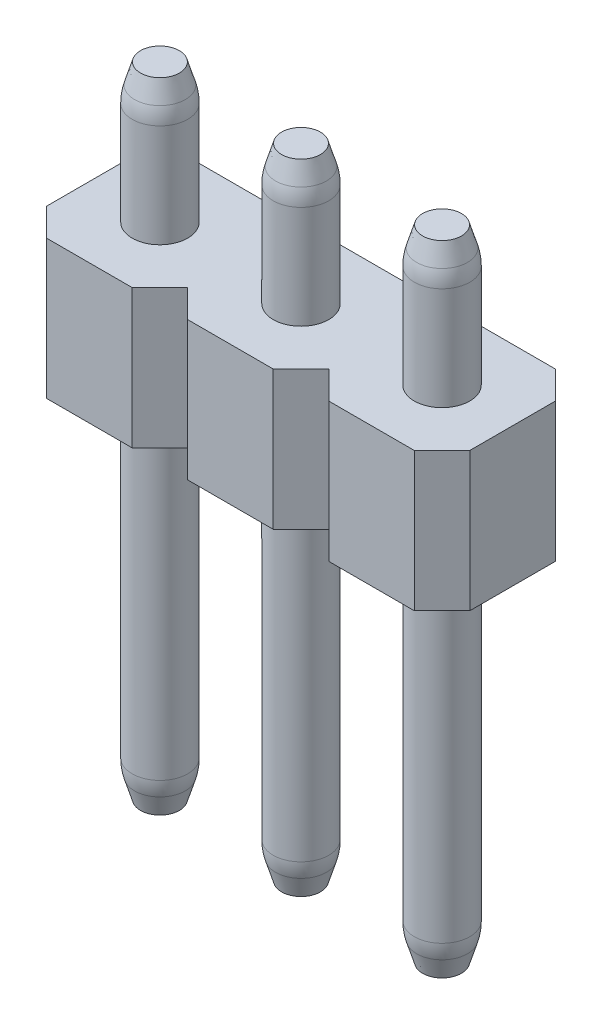
from build123d import *
from OCP.BRepFilletAPI import BRepFilletAPI_MakeChamfer

# Parameters (mm, degrees)
SKETCH1_R               = 0.5
BOSS_EXTRUDE1_DEPTH     = 11.5
BOSS_EXTRUDE1_2_DEPTH   = 11.5
BOSS_EXTRUDE1_3_DEPTH   = 11.5
BOSS_EXTRUDE1_4_DEPTH   = 11.5
BOSS_EXTRUDE1_5_DEPTH   = 11.5
BOSS_EXTRUDE1_6_DEPTH   = 11.5
BOSS_EXTRUDE1_7_DEPTH   = 11.5
BOSS_EXTRUDE1_8_DEPTH   = 11.5
BOSS_EXTRUDE1_9_DEPTH   = 11.5
BOSS_EXTRUDE1_10_DEPTH  = 11.5
BOSS_EXTRUDE1_11_DEPTH  = 11.5
BOSS_EXTRUDE1_12_DEPTH  = 11.5
BOSS_EXTRUDE1_13_DEPTH  = 11.5
BOSS_EXTRUDE1_14_DEPTH  = 11.5
BOSS_EXTRUDE1_15_DEPTH  = 11.5
BOSS_EXTRUDE1_16_DEPTH  = 11.5
BOSS_EXTRUDE2_DEPTH     = 2.5
CHAMFER1_SIZE           = 0.5
CHAMFER1_SIZE2          = 0.15
FILLET1_R               = 1
CHAMFER2_SIZE           = 0.15
CHAMFER2_SIZE2          = 0.5
FILLET2_R               = 1
CUT_EXTRUDE1_DEPTH      = 42.093776929
CUT_EXTRUDE1_DEPTH_BACK = 42.093776929


with BuildPart() as part:
    # Sketch1 → Boss-Extrude1 (new body)
    with BuildSketch(Plane(origin=(0, 0, 0), x_dir=(1, 0, 0), z_dir=(0, 1, 0))):
        with Locations(Location((0, 0, 0), (0, 0, 270))):
            Circle(SKETCH1_R)
    extrude(amount=BOSS_EXTRUDE1_DEPTH)



with BuildPart() as body_2:
    # Sketch1 → Boss-Extrude1 2 (new body)
    with BuildSketch(Plane(origin=(0, 0, 0), x_dir=(1, 0, 0), z_dir=(0, 1, 0))):
        with Locations(Location((2.54, 0, 0), (0, 0, 270))):
            Circle(SKETCH1_R)
    extrude(amount=BOSS_EXTRUDE1_2_DEPTH)


with BuildPart() as body_3:
    # Sketch1 → Boss-Extrude1 3 (new body)
    with BuildSketch(Plane(origin=(0, 0, 0), x_dir=(1, 0, 0), z_dir=(0, 1, 0))):
        with Locations(Location((5.08, 0, 0), (0, 0, 270))):
            Circle(SKETCH1_R)
    extrude(amount=BOSS_EXTRUDE1_3_DEPTH)


with BuildPart() as body_4:
    # Sketch1 → Boss-Extrude1 4 (new body)
    with BuildSketch(Plane(origin=(0, 0, 0), x_dir=(1, 0, 0), z_dir=(0, 1, 0))):
        with Locations(Location((7.62, 0, 0), (0, 0, 270))):
            Circle(SKETCH1_R)
    extrude(amount=BOSS_EXTRUDE1_4_DEPTH)


with BuildPart() as body_5:
    # Sketch1 → Boss-Extrude1 5 (new body)
    with BuildSketch(Plane(origin=(0, 0, 0), x_dir=(1, 0, 0), z_dir=(0, 1, 0))):
        with Locations(Location((10.16, 0, 0), (0, 0, 270))):
            Circle(SKETCH1_R)
    extrude(amount=BOSS_EXTRUDE1_5_DEPTH)


with BuildPart() as body_6:
    # Sketch1 → Boss-Extrude1 6 (new body)
    with BuildSketch(Plane(origin=(0, 0, 0), x_dir=(1, 0, 0), z_dir=(0, 1, 0))):
        with Locations(Location((12.7, 0, 0), (0, 0, 270))):
            Circle(SKETCH1_R)
    extrude(amount=BOSS_EXTRUDE1_6_DEPTH)


with BuildPart() as body_7:
    # Sketch1 → Boss-Extrude1 7 (new body)
    with BuildSketch(Plane(origin=(0, 0, 0), x_dir=(1, 0, 0), z_dir=(0, 1, 0))):
        with Locations(Location((15.24, 0, 0), (0, 0, 270))):
            Circle(SKETCH1_R)
    extrude(amount=BOSS_EXTRUDE1_7_DEPTH)


with BuildPart() as body_8:
    # Sketch1 → Boss-Extrude1 8 (new body)
    with BuildSketch(Plane(origin=(0, 0, 0), x_dir=(1, 0, 0), z_dir=(0, 1, 0))):
        with Locations(Location((17.78, 0, 0), (0, 0, 270))):
            Circle(SKETCH1_R)
    extrude(amount=BOSS_EXTRUDE1_8_DEPTH)


with BuildPart() as body_9:
    # Sketch1 → Boss-Extrude1 9 (new body)
    with BuildSketch(Plane(origin=(0, 0, 0), x_dir=(1, 0, 0), z_dir=(0, 1, 0))):
        with Locations(Location((20.32, 0, 0), (0, 0, 270))):
            Circle(SKETCH1_R)
    extrude(amount=BOSS_EXTRUDE1_9_DEPTH)


with BuildPart() as body_10:
    # Sketch1 → Boss-Extrude1 10 (new body)
    with BuildSketch(Plane(origin=(0, 0, 0), x_dir=(1, 0, 0), z_dir=(0, 1, 0))):
        with Locations(Location((22.86, 0, 0), (0, 0, 270))):
            Circle(SKETCH1_R)
    extrude(amount=BOSS_EXTRUDE1_10_DEPTH)


with BuildPart() as body_11:
    # Sketch1 → Boss-Extrude1 11 (new body)
    with BuildSketch(Plane(origin=(0, 0, 0), x_dir=(1, 0, 0), z_dir=(0, 1, 0))):
        with Locations(Location((25.4, 0, 0), (0, 0, 270))):
            Circle(SKETCH1_R)
    extrude(amount=BOSS_EXTRUDE1_11_DEPTH)


with BuildPart() as body_12:
    # Sketch1 → Boss-Extrude1 12 (new body)
    with BuildSketch(Plane(origin=(0, 0, 0), x_dir=(1, 0, 0), z_dir=(0, 1, 0))):
        with Locations(Location((27.94, 0, 0), (0, 0, 270))):
            Circle(SKETCH1_R)
    extrude(amount=BOSS_EXTRUDE1_12_DEPTH)


with BuildPart() as body_13:
    # Sketch1 → Boss-Extrude1 13 (new body)
    with BuildSketch(Plane(origin=(0, 0, 0), x_dir=(1, 0, 0), z_dir=(0, 1, 0))):
        with Locations(Location((30.48, 0, 0), (0, 0, 270))):
            Circle(SKETCH1_R)
    extrude(amount=BOSS_EXTRUDE1_13_DEPTH)


with BuildPart() as body_14:
    # Sketch1 → Boss-Extrude1 14 (new body)
    with BuildSketch(Plane(origin=(0, 0, 0), x_dir=(1, 0, 0), z_dir=(0, 1, 0))):
        with Locations(Location((33.02, 0, 0), (0, 0, 270))):
            Circle(SKETCH1_R)
    extrude(amount=BOSS_EXTRUDE1_14_DEPTH)


with BuildPart() as body_15:
    # Sketch1 → Boss-Extrude1 15 (new body)
    with BuildSketch(Plane(origin=(0, 0, 0), x_dir=(1, 0, 0), z_dir=(0, 1, 0))):
        with Locations(Location((35.56, 0, 0), (0, 0, 270))):
            Circle(SKETCH1_R)
    extrude(amount=BOSS_EXTRUDE1_15_DEPTH)


with BuildPart() as body_16:
    # Sketch1 → Boss-Extrude1 16 (new body)
    with BuildSketch(Plane(origin=(0, 0, 0), x_dir=(1, 0, 0), z_dir=(0, 1, 0))):
        with Locations(Location((38.1, 0, 0), (0, 0, 270))):
            Circle(SKETCH1_R)
    extrude(amount=BOSS_EXTRUDE1_16_DEPTH)


with BuildPart() as part_1:
    add(part.part)

    add(body_2.part)  # Boss-Extrude2 merges body 2

    add(body_3.part)  # Boss-Extrude2 merges body 3

    add(body_4.part)  # Boss-Extrude2 merges body 4

    add(body_5.part)  # Boss-Extrude2 merges body 5

    add(body_6.part)  # Boss-Extrude2 merges body 6

    add(body_7.part)  # Boss-Extrude2 merges body 7

    add(body_8.part)  # Boss-Extrude2 merges body 8

    add(body_9.part)  # Boss-Extrude2 merges body 9

    add(body_10.part)  # Boss-Extrude2 merges body 10

    add(body_11.part)  # Boss-Extrude2 merges body 11

    add(body_12.part)  # Boss-Extrude2 merges body 12

    add(body_13.part)  # Boss-Extrude2 merges body 13

    add(body_14.part)  # Boss-Extrude2 merges body 14

    add(body_15.part)  # Boss-Extrude2 merges body 15

    add(body_16.part)  # Boss-Extrude2 merges body 16
    # Sketch2 → Boss-Extrude2 (add)
    with BuildSketch(Plane(origin=(0, 6.5, 0), x_dir=(1, 0, 0), z_dir=(0, 1, 0))):
        Polygon((-1.27, 0.77), (-0.77, 1.27), (0.77, 1.27), (1.27, 0.77), (1.77, 1.27), (3.31, 1.27), (3.81, 0.77), (4.31, 1.27), (5.85, 1.27), (6.35, 0.77), (6.85, 1.27), (8.39, 1.27), (8.89, 0.77), (9.39, 1.27), (10.93, 1.27), (11.43, 0.77), (11.93, 1.27), (13.47, 1.27), (13.97, 0.77), (14.47, 1.27), (16.01, 1.27), (16.51, 0.77), (17.01, 1.27), (18.55, 1.27), (19.05, 0.77), (19.55, 1.27), (21.09, 1.27), (21.59, 0.77), (22.09, 1.27), (23.63, 1.27), (24.13, 0.77), (24.63, 1.27), (26.17, 1.27), (26.67, 0.77), (27.17, 1.27), (28.71, 1.27), (29.21, 0.77), (29.71, 1.27), (31.25, 1.27), (31.75, 0.77), (32.25, 1.27), (33.79, 1.27), (34.29, 0.77), (34.79, 1.27), (36.33, 1.27), (36.83, 0.77), (37.33, 1.27), (38.87, 1.27), (39.37, 0.77), (39.37, -0.77), (38.87, -1.27), (37.33, -1.27), (36.83, -0.77), (36.33, -1.27), (34.79, -1.27), (34.29, -0.77), (33.79, -1.27), (32.25, -1.27), (31.75, -0.77), (31.25, -1.27), (29.71, -1.27), (29.21, -0.77), (28.71, -1.27), (27.17, -1.27), (26.67, -0.77), (26.17, -1.27), (24.63, -1.27), (24.13, -0.77), (23.63, -1.27), (22.09, -1.27), (21.59, -0.77), (21.09, -1.27), (19.55, -1.27), (19.05, -0.77), (18.55, -1.27), (17.01, -1.27), (16.51, -0.77), (16.01, -1.27), (14.47, -1.27), (13.97, -0.77), (13.47, -1.27), (11.93, -1.27), (11.43, -0.77), (10.93, -1.27), (9.39, -1.27), (8.89, -0.77), (8.39, -1.27), (6.85, -1.27), (6.35, -0.77), (5.85, -1.27), (4.31, -1.27), (3.81, -0.77), (3.31, -1.27), (1.77, -1.27), (1.27, -0.77), (0.77, -1.27), (-0.77, -1.27), (-1.27, -0.77), align=None)
    extrude(amount=BOSS_EXTRUDE2_DEPTH)

    # Chamfer1: one chamfer whose edges measure the first distance from different faces: ONE call of the kernel's chamfer builder (chamfer() names one face for all edges)
    chamfer1_edges_1 = [part_1.edges().sort_by_distance(p)[0] for p in [
        (2.54, 11.5, -0.5),
    ]]
    chamfer1_side_1 = [part_1.faces().sort_by_distance(p)[0] for p in [
        (2.54, 10.25, -0.5),
    ]]
    chamfer1_edges_2 = [part_1.edges().sort_by_distance(p)[0] for p in [
        (5.08, 11.5, -0.5),
    ]]
    chamfer1_side_2 = [part_1.faces().sort_by_distance(p)[0] for p in [
        (5.08, 10.25, -0.5),
    ]]
    chamfer1_edges_3 = [part_1.edges().sort_by_distance(p)[0] for p in [
        (7.62, 11.5, -0.5),
    ]]
    chamfer1_side_3 = [part_1.faces().sort_by_distance(p)[0] for p in [
        (7.62, 10.25, -0.5),
    ]]
    chamfer1_edges_4 = [part_1.edges().sort_by_distance(p)[0] for p in [
        (10.16, 11.5, -0.5),
    ]]
    chamfer1_side_4 = [part_1.faces().sort_by_distance(p)[0] for p in [
        (10.16, 10.25, -0.5),
    ]]
    chamfer1_edges_5 = [part_1.edges().sort_by_distance(p)[0] for p in [
        (12.7, 11.5, -0.5),
    ]]
    chamfer1_side_5 = [part_1.faces().sort_by_distance(p)[0] for p in [
        (12.7, 10.25, -0.5),
    ]]
    chamfer1_edges_6 = [part_1.edges().sort_by_distance(p)[0] for p in [
        (15.24, 11.5, -0.5),
    ]]
    chamfer1_side_6 = [part_1.faces().sort_by_distance(p)[0] for p in [
        (15.24, 10.25, -0.5),
    ]]
    chamfer1_edges_7 = [part_1.edges().sort_by_distance(p)[0] for p in [
        (17.78, 11.5, -0.5),
    ]]
    chamfer1_side_7 = [part_1.faces().sort_by_distance(p)[0] for p in [
        (17.78, 10.25, -0.5),
    ]]
    chamfer1_edges_8 = [part_1.edges().sort_by_distance(p)[0] for p in [
        (20.32, 11.5, -0.5),
    ]]
    chamfer1_side_8 = [part_1.faces().sort_by_distance(p)[0] for p in [
        (20.32, 10.25, -0.5),
    ]]
    chamfer1_edges_9 = [part_1.edges().sort_by_distance(p)[0] for p in [
        (22.86, 11.5, -0.5),
    ]]
    chamfer1_side_9 = [part_1.faces().sort_by_distance(p)[0] for p in [
        (22.86, 10.25, -0.5),
    ]]
    chamfer1_edges_10 = [part_1.edges().sort_by_distance(p)[0] for p in [
        (25.4, 11.5, -0.5),
    ]]
    chamfer1_side_10 = [part_1.faces().sort_by_distance(p)[0] for p in [
        (25.4, 10.25, -0.5),
    ]]
    chamfer1_edges_11 = [part_1.edges().sort_by_distance(p)[0] for p in [
        (27.94, 11.5, -0.5),
    ]]
    chamfer1_side_11 = [part_1.faces().sort_by_distance(p)[0] for p in [
        (27.94, 10.25, -0.5),
    ]]
    chamfer1_edges_12 = [part_1.edges().sort_by_distance(p)[0] for p in [
        (30.48, 11.5, -0.5),
    ]]
    chamfer1_side_12 = [part_1.faces().sort_by_distance(p)[0] for p in [
        (30.48, 10.25, -0.5),
    ]]
    chamfer1_edges_13 = [part_1.edges().sort_by_distance(p)[0] for p in [
        (33.02, 11.5, -0.5),
    ]]
    chamfer1_side_13 = [part_1.faces().sort_by_distance(p)[0] for p in [
        (33.02, 10.25, -0.5),
    ]]
    chamfer1_edges_14 = [part_1.edges().sort_by_distance(p)[0] for p in [
        (35.56, 11.5, -0.5),
    ]]
    chamfer1_side_14 = [part_1.faces().sort_by_distance(p)[0] for p in [
        (35.56, 10.25, -0.5),
    ]]
    chamfer1_edges_15 = [part_1.edges().sort_by_distance(p)[0] for p in [
        (38.1, 11.5, -0.5),
    ]]
    chamfer1_side_15 = [part_1.faces().sort_by_distance(p)[0] for p in [
        (38.1, 10.25, -0.5),
    ]]
    chamfer1_edges_16 = [part_1.edges().sort_by_distance(p)[0] for p in [
        (0, 11.5, -0.5),
    ]]
    chamfer1_side_16 = [part_1.faces().sort_by_distance(p)[0] for p in [
        (0, 10.25, -0.5),
    ]]
    chamfer1 = BRepFilletAPI_MakeChamfer(part_1.part.solid().wrapped)
    for e in chamfer1_edges_1:
        chamfer1.Add(CHAMFER1_SIZE, CHAMFER1_SIZE2, e.wrapped, chamfer1_side_1[0].wrapped)  # the first distance lies on this face
    for e in chamfer1_edges_2:
        chamfer1.Add(CHAMFER1_SIZE, CHAMFER1_SIZE2, e.wrapped, chamfer1_side_2[0].wrapped)  # the first distance lies on this face
    for e in chamfer1_edges_3:
        chamfer1.Add(CHAMFER1_SIZE, CHAMFER1_SIZE2, e.wrapped, chamfer1_side_3[0].wrapped)  # the first distance lies on this face
    for e in chamfer1_edges_4:
        chamfer1.Add(CHAMFER1_SIZE, CHAMFER1_SIZE2, e.wrapped, chamfer1_side_4[0].wrapped)  # the first distance lies on this face
    for e in chamfer1_edges_5:
        chamfer1.Add(CHAMFER1_SIZE, CHAMFER1_SIZE2, e.wrapped, chamfer1_side_5[0].wrapped)  # the first distance lies on this face
    for e in chamfer1_edges_6:
        chamfer1.Add(CHAMFER1_SIZE, CHAMFER1_SIZE2, e.wrapped, chamfer1_side_6[0].wrapped)  # the first distance lies on this face
    for e in chamfer1_edges_7:
        chamfer1.Add(CHAMFER1_SIZE, CHAMFER1_SIZE2, e.wrapped, chamfer1_side_7[0].wrapped)  # the first distance lies on this face
    for e in chamfer1_edges_8:
        chamfer1.Add(CHAMFER1_SIZE, CHAMFER1_SIZE2, e.wrapped, chamfer1_side_8[0].wrapped)  # the first distance lies on this face
    for e in chamfer1_edges_9:
        chamfer1.Add(CHAMFER1_SIZE, CHAMFER1_SIZE2, e.wrapped, chamfer1_side_9[0].wrapped)  # the first distance lies on this face
    for e in chamfer1_edges_10:
        chamfer1.Add(CHAMFER1_SIZE, CHAMFER1_SIZE2, e.wrapped, chamfer1_side_10[0].wrapped)  # the first distance lies on this face
    for e in chamfer1_edges_11:
        chamfer1.Add(CHAMFER1_SIZE, CHAMFER1_SIZE2, e.wrapped, chamfer1_side_11[0].wrapped)  # the first distance lies on this face
    for e in chamfer1_edges_12:
        chamfer1.Add(CHAMFER1_SIZE, CHAMFER1_SIZE2, e.wrapped, chamfer1_side_12[0].wrapped)  # the first distance lies on this face
    for e in chamfer1_edges_13:
        chamfer1.Add(CHAMFER1_SIZE, CHAMFER1_SIZE2, e.wrapped, chamfer1_side_13[0].wrapped)  # the first distance lies on this face
    for e in chamfer1_edges_14:
        chamfer1.Add(CHAMFER1_SIZE, CHAMFER1_SIZE2, e.wrapped, chamfer1_side_14[0].wrapped)  # the first distance lies on this face
    for e in chamfer1_edges_15:
        chamfer1.Add(CHAMFER1_SIZE, CHAMFER1_SIZE2, e.wrapped, chamfer1_side_15[0].wrapped)  # the first distance lies on this face
    for e in chamfer1_edges_16:
        chamfer1.Add(CHAMFER1_SIZE, CHAMFER1_SIZE2, e.wrapped, chamfer1_side_16[0].wrapped)  # the first distance lies on this face
    add(Compound.cast(chamfer1.Shape()), mode=Mode.REPLACE)

    # Fillet1
    fillet1_edges = [part_1.edges().sort_by_distance(p)[0] for p in [
        (38.1, 11, -0.5),
        (35.56, 11, -0.5),
        (33.02, 11, -0.5),
        (30.48, 11, -0.5),
        (27.94, 11, -0.5),
        (25.4, 11, -0.5),
        (22.86, 11, -0.5),
        (20.32, 11, -0.5),
        (17.78, 11, -0.5),
        (15.24, 11, -0.5),
        (12.7, 11, -0.5),
        (10.16, 11, -0.5),
        (7.62, 11, -0.5),
        (5.08, 11, -0.5),
        (2.54, 11, -0.5),
        (0, 11, -0.5),
    ]]
    fillet(fillet1_edges, radius=FILLET1_R)

    # Chamfer2: one chamfer whose edges measure the first distance from different faces: ONE call of the kernel's chamfer builder (chamfer() names one face for all edges)
    chamfer2_edges_1 = [part_1.edges().sort_by_distance(p)[0] for p in [
        (0, 0, -0.5),
    ]]
    chamfer2_side_1 = [part_1.faces().sort_by_distance(p)[0] for p in [
        (0, 0, 0),
    ]]
    chamfer2_edges_2 = [part_1.edges().sort_by_distance(p)[0] for p in [
        (2.54, 0, -0.5),
    ]]
    chamfer2_side_2 = [part_1.faces().sort_by_distance(p)[0] for p in [
        (2.54, 0, 0),
    ]]
    chamfer2_edges_3 = [part_1.edges().sort_by_distance(p)[0] for p in [
        (5.08, 0, -0.5),
    ]]
    chamfer2_side_3 = [part_1.faces().sort_by_distance(p)[0] for p in [
        (5.08, 0, 0),
    ]]
    chamfer2_edges_4 = [part_1.edges().sort_by_distance(p)[0] for p in [
        (7.62, 0, -0.5),
    ]]
    chamfer2_side_4 = [part_1.faces().sort_by_distance(p)[0] for p in [
        (7.62, 0, 0),
    ]]
    chamfer2_edges_5 = [part_1.edges().sort_by_distance(p)[0] for p in [
        (10.16, 0, -0.5),
    ]]
    chamfer2_side_5 = [part_1.faces().sort_by_distance(p)[0] for p in [
        (10.16, 0, 0),
    ]]
    chamfer2_edges_6 = [part_1.edges().sort_by_distance(p)[0] for p in [
        (12.7, 0, -0.5),
    ]]
    chamfer2_side_6 = [part_1.faces().sort_by_distance(p)[0] for p in [
        (12.7, 0, 0),
    ]]
    chamfer2_edges_7 = [part_1.edges().sort_by_distance(p)[0] for p in [
        (15.24, 0, -0.5),
    ]]
    chamfer2_side_7 = [part_1.faces().sort_by_distance(p)[0] for p in [
        (15.24, 0, 0),
    ]]
    chamfer2_edges_8 = [part_1.edges().sort_by_distance(p)[0] for p in [
        (17.78, 0, -0.5),
    ]]
    chamfer2_side_8 = [part_1.faces().sort_by_distance(p)[0] for p in [
        (17.78, 0, 0),
    ]]
    chamfer2_edges_9 = [part_1.edges().sort_by_distance(p)[0] for p in [
        (20.32, 0, -0.5),
    ]]
    chamfer2_side_9 = [part_1.faces().sort_by_distance(p)[0] for p in [
        (20.32, 0, 0),
    ]]
    chamfer2_edges_10 = [part_1.edges().sort_by_distance(p)[0] for p in [
        (22.86, 0, -0.5),
    ]]
    chamfer2_side_10 = [part_1.faces().sort_by_distance(p)[0] for p in [
        (22.86, 0, 0),
    ]]
    chamfer2_edges_11 = [part_1.edges().sort_by_distance(p)[0] for p in [
        (25.4, 0, -0.5),
    ]]
    chamfer2_side_11 = [part_1.faces().sort_by_distance(p)[0] for p in [
        (25.4, 0, 0),
    ]]
    chamfer2_edges_12 = [part_1.edges().sort_by_distance(p)[0] for p in [
        (27.94, 0, -0.5),
    ]]
    chamfer2_side_12 = [part_1.faces().sort_by_distance(p)[0] for p in [
        (27.94, 0, 0),
    ]]
    chamfer2_edges_13 = [part_1.edges().sort_by_distance(p)[0] for p in [
        (30.48, 0, -0.5),
    ]]
    chamfer2_side_13 = [part_1.faces().sort_by_distance(p)[0] for p in [
        (30.48, 0, 0),
    ]]
    chamfer2_edges_14 = [part_1.edges().sort_by_distance(p)[0] for p in [
        (33.02, 0, -0.5),
    ]]
    chamfer2_side_14 = [part_1.faces().sort_by_distance(p)[0] for p in [
        (33.02, 0, 0),
    ]]
    chamfer2_edges_15 = [part_1.edges().sort_by_distance(p)[0] for p in [
        (35.56, 0, -0.5),
    ]]
    chamfer2_side_15 = [part_1.faces().sort_by_distance(p)[0] for p in [
        (35.56, 0, 0),
    ]]
    chamfer2_edges_16 = [part_1.edges().sort_by_distance(p)[0] for p in [
        (38.1, 0, -0.5),
    ]]
    chamfer2_side_16 = [part_1.faces().sort_by_distance(p)[0] for p in [
        (38.1, 0, 0),
    ]]
    chamfer2 = BRepFilletAPI_MakeChamfer(part_1.part.solid().wrapped)
    for e in chamfer2_edges_1:
        chamfer2.Add(CHAMFER2_SIZE, CHAMFER2_SIZE2, e.wrapped, chamfer2_side_1[0].wrapped)  # the first distance lies on this face
    for e in chamfer2_edges_2:
        chamfer2.Add(CHAMFER2_SIZE, CHAMFER2_SIZE2, e.wrapped, chamfer2_side_2[0].wrapped)  # the first distance lies on this face
    for e in chamfer2_edges_3:
        chamfer2.Add(CHAMFER2_SIZE, CHAMFER2_SIZE2, e.wrapped, chamfer2_side_3[0].wrapped)  # the first distance lies on this face
    for e in chamfer2_edges_4:
        chamfer2.Add(CHAMFER2_SIZE, CHAMFER2_SIZE2, e.wrapped, chamfer2_side_4[0].wrapped)  # the first distance lies on this face
    for e in chamfer2_edges_5:
        chamfer2.Add(CHAMFER2_SIZE, CHAMFER2_SIZE2, e.wrapped, chamfer2_side_5[0].wrapped)  # the first distance lies on this face
    for e in chamfer2_edges_6:
        chamfer2.Add(CHAMFER2_SIZE, CHAMFER2_SIZE2, e.wrapped, chamfer2_side_6[0].wrapped)  # the first distance lies on this face
    for e in chamfer2_edges_7:
        chamfer2.Add(CHAMFER2_SIZE, CHAMFER2_SIZE2, e.wrapped, chamfer2_side_7[0].wrapped)  # the first distance lies on this face
    for e in chamfer2_edges_8:
        chamfer2.Add(CHAMFER2_SIZE, CHAMFER2_SIZE2, e.wrapped, chamfer2_side_8[0].wrapped)  # the first distance lies on this face
    for e in chamfer2_edges_9:
        chamfer2.Add(CHAMFER2_SIZE, CHAMFER2_SIZE2, e.wrapped, chamfer2_side_9[0].wrapped)  # the first distance lies on this face
    for e in chamfer2_edges_10:
        chamfer2.Add(CHAMFER2_SIZE, CHAMFER2_SIZE2, e.wrapped, chamfer2_side_10[0].wrapped)  # the first distance lies on this face
    for e in chamfer2_edges_11:
        chamfer2.Add(CHAMFER2_SIZE, CHAMFER2_SIZE2, e.wrapped, chamfer2_side_11[0].wrapped)  # the first distance lies on this face
    for e in chamfer2_edges_12:
        chamfer2.Add(CHAMFER2_SIZE, CHAMFER2_SIZE2, e.wrapped, chamfer2_side_12[0].wrapped)  # the first distance lies on this face
    for e in chamfer2_edges_13:
        chamfer2.Add(CHAMFER2_SIZE, CHAMFER2_SIZE2, e.wrapped, chamfer2_side_13[0].wrapped)  # the first distance lies on this face
    for e in chamfer2_edges_14:
        chamfer2.Add(CHAMFER2_SIZE, CHAMFER2_SIZE2, e.wrapped, chamfer2_side_14[0].wrapped)  # the first distance lies on this face
    for e in chamfer2_edges_15:
        chamfer2.Add(CHAMFER2_SIZE, CHAMFER2_SIZE2, e.wrapped, chamfer2_side_15[0].wrapped)  # the first distance lies on this face
    for e in chamfer2_edges_16:
        chamfer2.Add(CHAMFER2_SIZE, CHAMFER2_SIZE2, e.wrapped, chamfer2_side_16[0].wrapped)  # the first distance lies on this face
    add(Compound.cast(chamfer2.Shape()), mode=Mode.REPLACE)

    # Fillet2
    fillet2_edges = [part_1.edges().sort_by_distance(p)[0] for p in [
        (10.16, 0.5, -0.5),
        (17.78, 0.5, -0.5),
        (22.86, 0.5, -0.5),
        (27.94, 0.5, -0.5),
        (30.48, 0.5, -0.5),
        (0, 0.5, -0.5),
        (2.54, 0.5, -0.5),
        (5.08, 0.5, -0.5),
        (7.62, 0.5, -0.5),
        (12.7, 0.5, -0.5),
        (15.24, 0.5, -0.5),
        (20.32, 0.5, -0.5),
        (25.4, 0.5, -0.5),
        (33.02, 0.5, -0.5),
        (35.56, 0.5, -0.5),
        (38.1, 0.5, -0.5),
    ]]
    fillet(fillet2_edges, radius=FILLET2_R)

    # Sketch3 → Cut-Extrude1 (cut, two sides: drawn at the far end of the back side and taken through both)
    with BuildSketch(Plane(origin=(0, 0, -1.27), x_dir=(-1, 0, 0), z_dir=(0, 0, -1)).offset(-CUT_EXTRUDE1_DEPTH_BACK)):
        Polygon((-31.75, 11.5), (-31.75, 0), (-40.282511818, 0), (-40.282511818, 14.702627998), align=None)
        Polygon((-24.13, 11.5), (-24.13, 0), (2.40719131, -1.427988579), (2.361545608, 11.5), align=None)
    extrude(amount=CUT_EXTRUDE1_DEPTH + CUT_EXTRUDE1_DEPTH_BACK, mode=Mode.SUBTRACT)


solid = part_1.part
